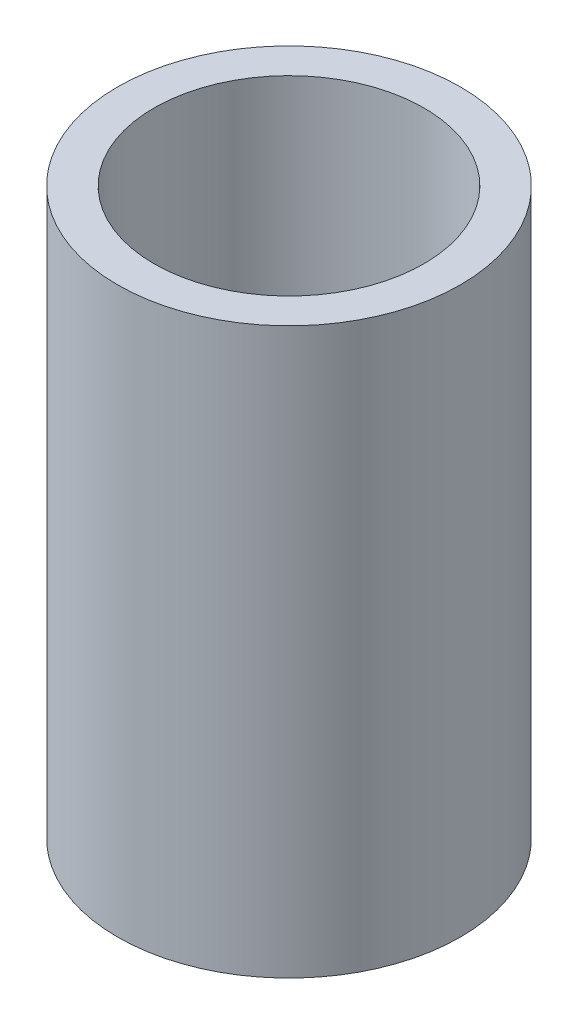
from build123d import *

# Parameters (mm, degrees)
SKETCH1_R           = 2.54
SKETCH1_R_2         = 2
BOSS_EXTRUDE1_DEPTH = 8.37


with BuildPart() as part:
    # Sketch1 → Boss-Extrude1 (new body)
    with BuildSketch(Plane(origin=(0, 0, 0), x_dir=(1, 0, 0), z_dir=(0, 1, 0))):
        with Locations(Location((0, 0, 0), (0, 0, 270))):
            Circle(SKETCH1_R)
        with Locations(Location((0, 0, 0), (0, 0, 270))):
            Circle(SKETCH1_R_2, mode=Mode.SUBTRACT)
    extrude(amount=-BOSS_EXTRUDE1_DEPTH)


solid = part.part
